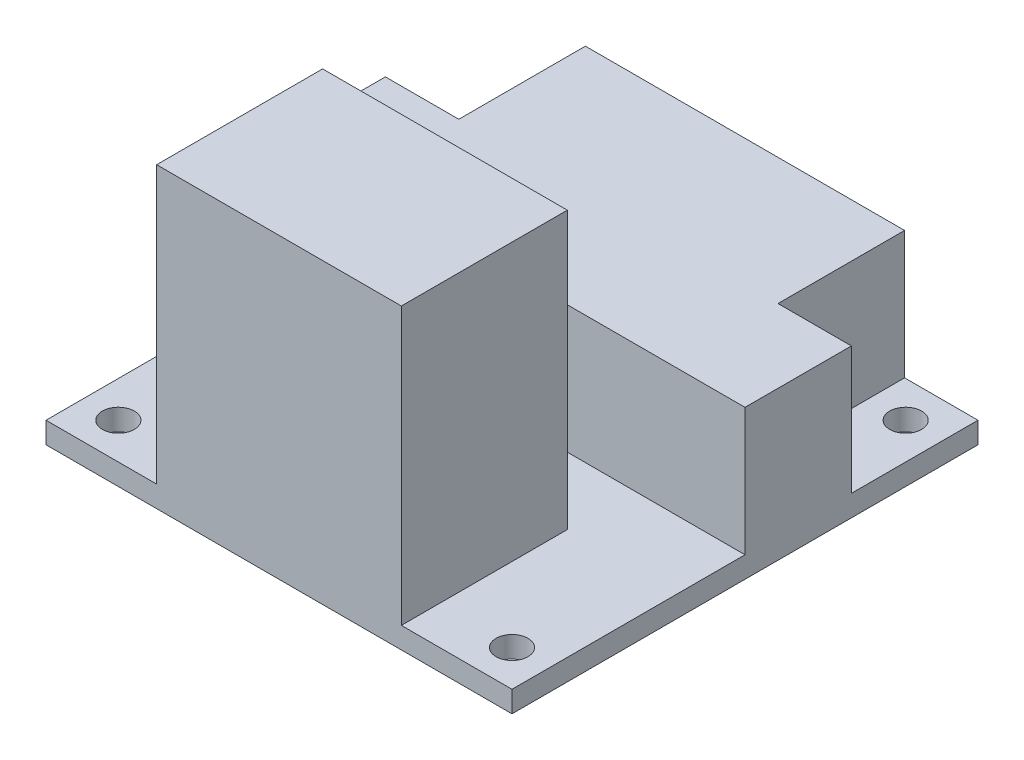
from build123d import *

# Parameters (mm, degrees)
ESBO_O1_W                = 43.8
ESBO_O1_H                = 43.8
ESBO_O1_R                = 1.5
RESSALTO_EXTRUS_O1_DEPTH = 2
ESBO_O2_W                = 23
ESBO_O2_H                = 15.6
RESSALTO_EXTRUS_O2_DEPTH = 26
ESBO_O3_W                = 6.9
ESBO_O3_H                = 10
ESBO_O3_W_2              = 30
ESBO_O3_H_2              = 11.9
RESSALTO_EXTRUS_O3_DEPTH = 12


with BuildPart() as part:
    # Esboço1 → Ressalto-extrusão1 (new body)
    with BuildSketch(Plane(origin=(0, 0, 0), x_dir=(1, 0, 0), z_dir=(0, 1, 0))):
        Rectangle(ESBO_O1_W, ESBO_O1_H)
        with Locations(Location((18.5, 18.5, 0), (0, 0, 270))):
            Circle(ESBO_O1_R, mode=Mode.SUBTRACT)
        with Locations(Location((-18.5, 18.5, 0), (0, 0, 270))):
            Circle(ESBO_O1_R, mode=Mode.SUBTRACT)
        with Locations(Location((18.5, -18.5, 0), (0, 0, 270))):
            Circle(ESBO_O1_R, mode=Mode.SUBTRACT)
        with Locations(Location((-18.5, -18.5, 0), (0, 0, 270))):
            Circle(ESBO_O1_R, mode=Mode.SUBTRACT)
    extrude(amount=RESSALTO_EXTRUS_O1_DEPTH)

    # Esboço2 → Ressalto-extrusão2 (add)
    with BuildSketch(Plane(origin=(0, 2, 0), x_dir=(1, 0, 0), z_dir=(0, 1, 0))):
        with Locations((0, -14.1)):
            Rectangle(ESBO_O2_W, ESBO_O2_H)
    extrude(amount=RESSALTO_EXTRUS_O2_DEPTH)

    # Esboço3 → Ressalto-extrusão3 (add)
    with BuildSketch(Plane(origin=(0, 2, 0), x_dir=(1, 0, 0), z_dir=(0, 1, 0))):
        with Locations((-18.45, 5)):
            Rectangle(ESBO_O3_W, ESBO_O3_H)
        with Locations((18.45, 5)):
            Rectangle(ESBO_O3_W, ESBO_O3_H)
        with Locations((0, 15.95)):
            Rectangle(ESBO_O3_W_2, ESBO_O3_H_2)
        with Locations((0, 5)):
            Rectangle(ESBO_O3_W_2, ESBO_O3_H)
    extrude(amount=RESSALTO_EXTRUS_O3_DEPTH)


solid = part.part
